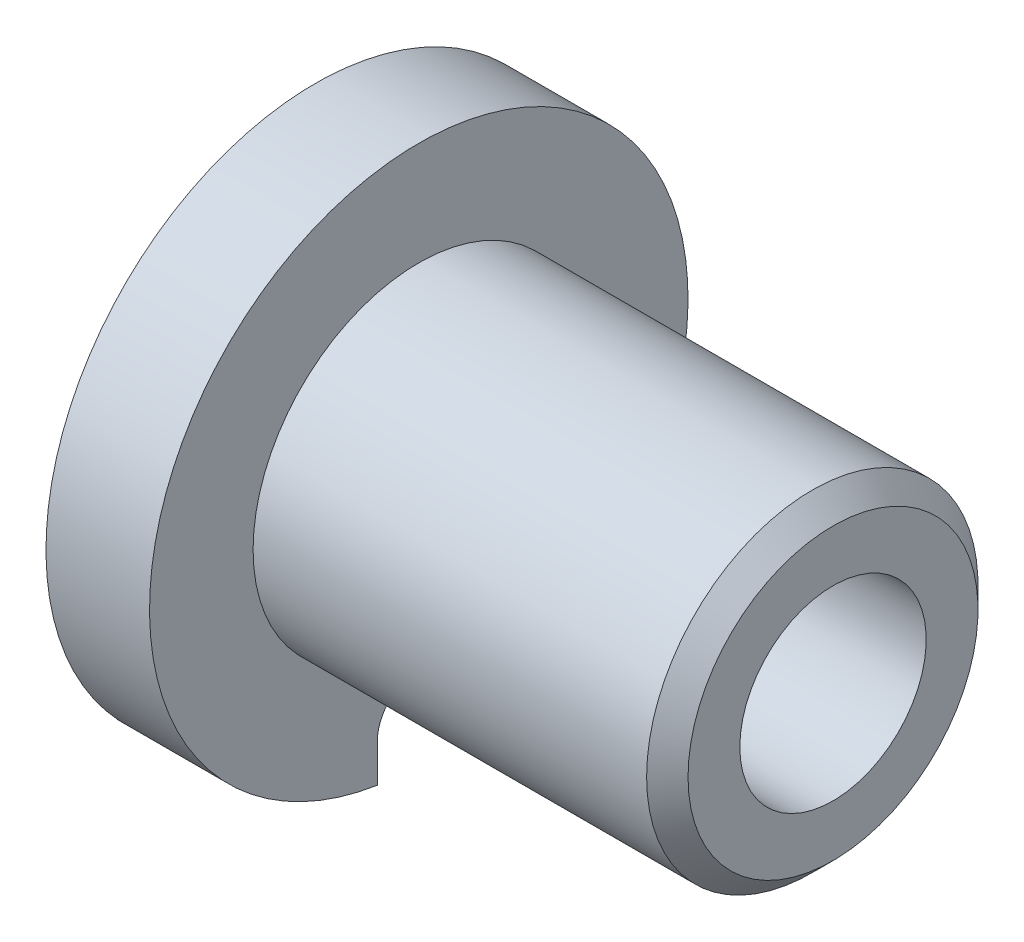
from build123d import *

# Parameters (mm, degrees)
CHANFREIN2_SIZE         = 1
ENL_V_MAT_EXTRU_1_DEPTH = 32.032241298


with BuildPart() as part:
    # Esquisse1 → Base-Révolution (revolve)
    with BuildSketch(Plane.XY, mode=Mode.PRIVATE) as base_r_volution_sk:
        Polygon((0, 4.5), (25, 4.5), (25, 8), (5, 8), (5, 13), (0, 13), align=None)
    revolve(base_r_volution_sk.sketch.rotate(Axis((0, 0, 0), (1, 0, 0)), 90), axis=Axis((0, 0, 0), (1, 0, 0)))

    # Chanfrein2
    chanfrein2_edges = [part.edges().sort_by_distance(p)[0] for p in [
        (25, 0, -8),
    ]]
    chamfer(chanfrein2_edges, length=CHANFREIN2_SIZE)

    # Esquisse2 → Enlèv. mat.-Extru.1 (cut, through all)
    with BuildSketch(Plane.ZY):
        with BuildLine():
            Line((2, -11), (2, -12.845232579))
            ThreePointArc((2, -12.845232579), (0, -13), (-2, -12.845232579))
            Line((-2, -12.845232579), (-2, -11))
            ThreePointArc((-2, -11), (0, -9), (2, -11))
        make_face()
    extrude(amount=-ENL_V_MAT_EXTRU_1_DEPTH, mode=Mode.SUBTRACT)


solid = part.part
